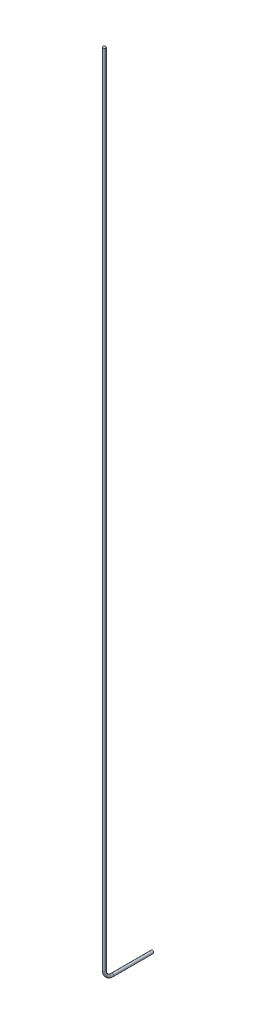
from build123d import *

# Parameters (mm, degrees)
SKETCH_1_R      = 0.9
EXTRUDE_1_DEPTH = 20
SKETCH_2_R      = 0.9


with BuildPart() as part:
    # ｽｹｯﾁ1 → ﾎﾞｽ - 押し出し1 (new body)
    with BuildSketch(Plane.XY):
        Circle(SKETCH_1_R)
    extrude(amount=EXTRUDE_1_DEPTH)

    # ｽｲｰﾌﾟ1: sweep along a path in ｽｹｯﾁ3
    with BuildLine(Plane(origin=(0, 0, 0), x_dir=(0, 0, -1), z_dir=(1, 0, 0))) as sweep_1_path:
        Line((-20, 0), (-25, 0))
        ThreePointArc((-25, 0), (-28.535533906, 1.464466094), (-30, 5))
        Line((-30, 5), (-30, 505))
    # ｽｹｯﾁ2 → ｽｲｰﾌﾟ1 (sweep)
    with BuildSketch(Plane.XY.offset(20)):
        Circle(SKETCH_2_R)
    sweep(path=sweep_1_path.line)


solid = part.part
